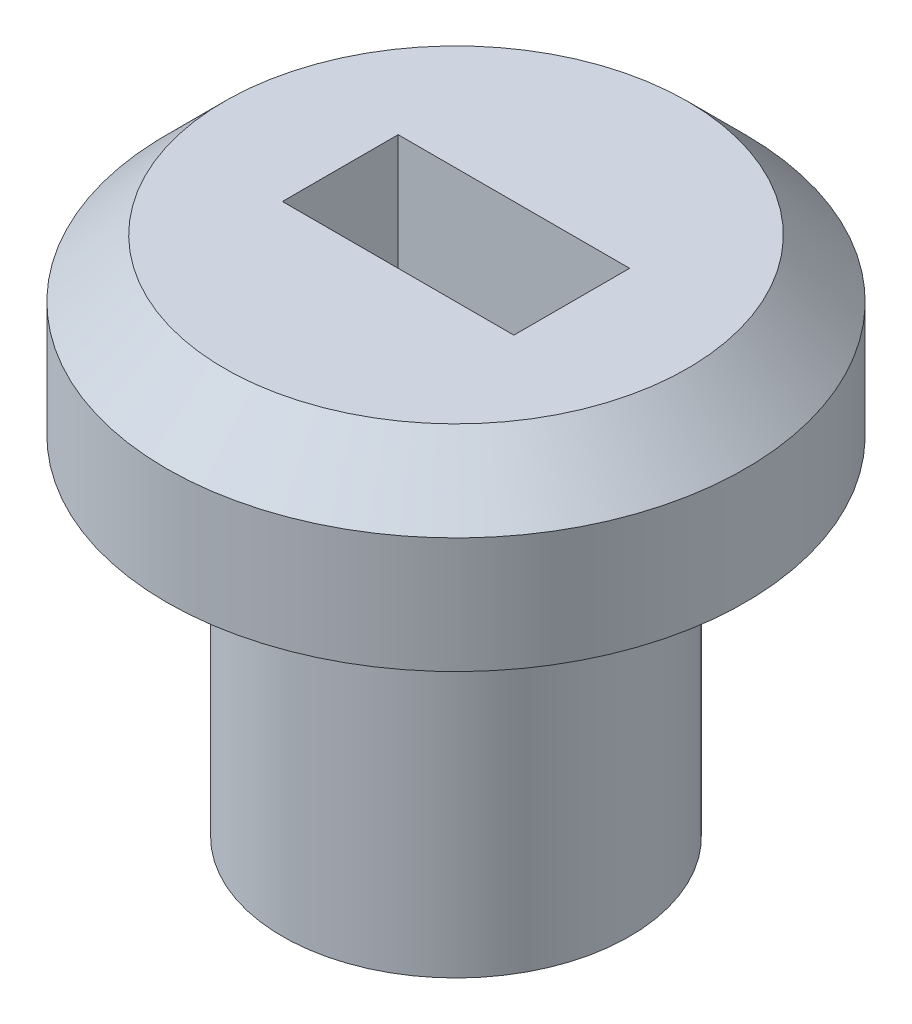
from build123d import *

# Parameters (mm, degrees)
CHAMFER1_SIZE      = 0.5
SKETCH2_W          = 2
SKETCH2_H          = 1
CUT_EXTRUDE1_DEPTH = 1


with BuildPart() as part:
    # Sketch1 → Revolve1 (revolve)
    with BuildSketch(Plane.XY, mode=Mode.PRIVATE) as revolve1_sk:
        Polygon((0, 3.5), (-0.5, 3.5), (-0.5, 4.5), (-2.5, 4.5), (-2.5, 3), (-1.5, 3), (-1.5, 0), (0, 0), align=None)
    revolve(revolve1_sk.sketch.rotate(Axis((0, 0, 0), (0, 1, 0)), 270), axis=Axis((0, 0, 0), (0, 1, 0)))

    # Chamfer1
    chamfer1_edges = [part.edges().sort_by_distance(p)[0] for p in [
        (0, 4.5, 2.5),
    ]]
    chamfer(chamfer1_edges, length=CHAMFER1_SIZE)

    # Sketch2 → Cut-Extrude1 (cut)
    with BuildSketch(Plane(origin=(0, 4.5, 0), x_dir=(1, 0, 0), z_dir=(0, 1, 0))):
        Rectangle(SKETCH2_W, SKETCH2_H)
    extrude(amount=-CUT_EXTRUDE1_DEPTH, mode=Mode.SUBTRACT)


solid = part.part
